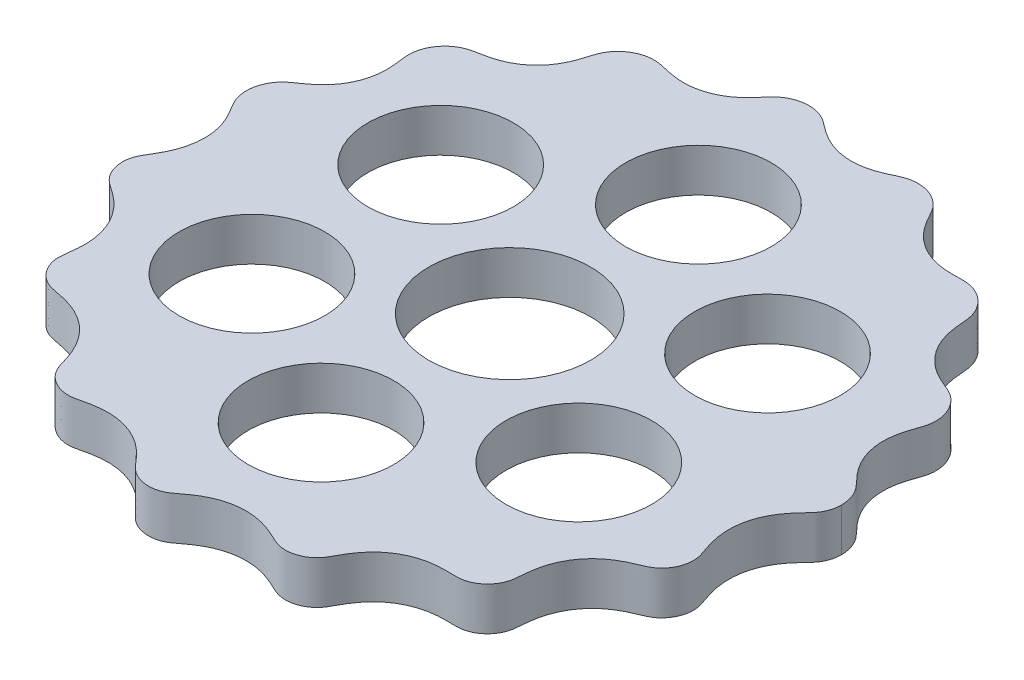
from build123d import *

# Parameters (mm, degrees)
SKETCH2_R           = 7.5
SKETCH2_R_2         = 6.75
BOSS_EXTRUDE1_DEPTH = 4


with BuildPart() as part:
    # Sketch2 → Boss-Extrude1 (new body)
    with BuildSketch(Plane(origin=(0, 0, 0), x_dir=(1, 0, 0), z_dir=(0, 1, 0))):
        with BuildLine():
            add(Edge.make_bspline(
                [(-29.5, 0), (-29.5, -0.029889461), (-29.500501274, -0.089793684), (-29.502757018, -0.199994007), (-29.508769472, -0.345716178), (-29.520033852, -0.516003517), (-29.539534103, -0.719877503), (-29.572667516, -0.972896461), (-29.625712231, -1.26893095), (-29.695940045, -1.57589139), (-29.785086374, -1.891206047), (-29.915742198, -2.279302585), (-30.102039584, -2.734864508), (-30.33495462, -3.200835277), (-30.612620381, -3.677587615), (-30.934069136, -4.194030434), (-31.237194706, -4.727278247), (-31.406093828, -5.378461077), (-31.405725242, -6.117189546), (-31.248335855, -6.800339452), (-30.946423484, -7.409498164), (-30.518681828, -7.912396516), (-30.024477359, -8.2774), (-29.550245165, -8.59502081), (-29.055422495, -8.956812811), (-28.55664588, -9.3787878), (-28.071291676, -9.87632012), (-27.618832314, -10.456259632), (-27.233514149, -11.088357289), (-26.923199049, -11.765079402), (-26.693739537, -12.478190143), (-26.549212855, -13.217291653), (-26.492855654, -13.928538721), (-26.50654453, -14.600813106), (-26.567292453, -15.230937345), (-26.651155977, -15.816199005), (-26.716674088, -16.447312982), (-26.62640489, -17.120976223), (-26.35876322, -17.782346644), (-25.918177073, -18.386904665), (-25.381295585, -18.836179949), (-24.795065003, -19.123538297), (-24.20416515, -19.259668921), (-23.651405896, -19.354435046), (-23.149147383, -19.460869188), (-22.701549759, -19.580730556), (-22.221250647, -19.739640946), (-21.713789444, -19.946736544), (-21.145635648, -20.241997885), (-20.533661927, -20.654546757), (-19.969318303, -21.140042744), (-19.462201082, -21.693788885), (-19.020819266, -22.308674205), (-18.671631778, -22.936971669), (-18.402935315, -23.560968071), (-18.196614764, -24.168544426), (-18.031210068, -24.746637991), (-17.836824154, -25.359563266), (-17.481845811, -25.947378552), (-16.962995745, -26.453160111), (-16.302610967, -26.834433706), (-15.605165751, -27.030879963), (-14.918614525, -27.044392858), (-14.290611017, -26.906273022), (-13.707268128, -26.76047143), (-13.077925596, -26.635361227), (-12.403190484, -26.556062439), (-11.684458703, -26.544316545), (-10.931287881, -26.619125576), (-10.198128539, -26.78142275), (-9.495575967, -27.027420956), (-8.914400316, -27.31099678), (-8.446794063, -27.597140689), (-8.075855138, -27.863479964), (-7.791280828, -28.092219953), (-7.481579097, -28.367944206), (-7.154069437, -28.695657759), (-6.810708629, -29.077401095), (-6.45228992, -29.50872604), (-6.038931991, -29.952392783), (-5.496965868, -30.316405455), (-4.839435928, -30.556720046), (-4.095583639, -30.636000314), (-3.38899707, -30.537099289), (-2.760454369, -30.27844327), (-2.246651709, -29.906145821), (-1.781732794, -29.540887108), (-1.266402425, -29.173215737), (-0.691041037, -28.825223584), (-0.046903188, -28.518406928), (0.66543903, -28.274019755), (1.397743593, -28.116182477), (2.138955211, -28.046561644), (2.879034252, -28.064209022), (3.607493969, -28.166079072), (4.281067062, -28.337644457), (4.895863657, -28.558606199), (5.456648804, -28.806245606), (5.968747032, -29.058121981), (6.532079721, -29.303629152), (7.181276314, -29.422592585), (7.882649472, -29.378078239), (8.594278351, -29.15231418), (9.198278317, -28.780347353), (9.667919205, -28.297811687), (9.987828208, -27.756370733), (10.260491808, -27.237871371), (10.576767616, -26.696230387), (10.953650895, -26.146870654), (11.408815704, -25.605953656), (11.950184555, -25.092464451), (12.548165998, -24.645439778), (13.194493936, -24.272282169), (13.88061938, -23.977927385), (14.595998502, -23.765832809), (15.292028768, -23.642107021), (15.956229893, -23.590396394), (16.583442648, -23.587314002), (17.168808068, -23.610430078), (17.79766419, -23.604101232), (18.450372779, -23.438648125), (19.074505483, -23.101552224), (19.625837334, -22.598145566), (20.015074466, -22.012995768), (20.23664741, -21.391293307), (20.305698303, -20.780679307), (20.343616085, -20.211251037), (20.409546628, -19.601777164), (20.525586467, -18.958866797), (20.713792994, -18.28975274), (20.98980086, -17.607953023), (21.344557209, -16.958202197), (21.775456582, -16.351104338), (22.2782997, -15.795828927), (22.846116736, -15.301115548), (23.433895979, -14.896684969), (24.022947843, -14.572402127), (24.599023965, -14.309950779), (25.147809675, -14.089945054), (25.727125692, -13.831132821), (26.26540634, -13.416119), (26.704339817, -12.853660239), (27.007624154, -12.169804958), (27.128243584, -11.480242215), (27.084026477, -10.828826935), (26.906402138, -10.249106449), (26.7122212, -9.722867749), (26.524712227, -9.148060531), (26.36609006, -8.521461383), (26.260469314, -7.840015999), (26.22782757, -7.109204715), (26.279232637, -6.372836761), (26.417456605, -5.641378167), (26.643471264, -4.925378903), (26.916327948, -4.321772504), (27.198539155, -3.829853606), (27.494220956, -3.391733715), (27.793312582, -3.00332682), (28.153637798, -2.591986094), (28.572215157, -2.159464513), (28.90921809, -1.789990126), (29.124632087, -1.45558278), (29.252718115, -1.193085775), (29.323765371, -1.017900193), (29.382904352, -0.838786396), (29.4301833, -0.65550882), (29.461173363, -0.493251706), (29.480345975, -0.355378471), (29.491402713, -0.233802562), (29.497298265, -0.132392574), (29.499508775, -0.061726851), (29.5, -0.020506856), (29.5, 0)],
                knots=[0.063267729, 0.063267729, 0.063267729, 0.063267729, 0.063267729, 0.064441566, 0.065615404, 0.066789241, 0.067963079, 0.070310753, 0.072658428, 0.075454292, 0.078250156, 0.081046021, 0.083841885, 0.089433613, 0.095025341, 0.098832185, 0.102639028, 0.110252715, 0.115841232, 0.121429749, 0.127692743, 0.133955737, 0.138834056, 0.143712374, 0.148590693, 0.153469011, 0.15973469, 0.166000368, 0.172266046, 0.178531725, 0.184946169, 0.191360613, 0.197775057, 0.204189501, 0.209244271, 0.214299041, 0.219353812, 0.224408582, 0.230819531, 0.23723048, 0.243460713, 0.249690946, 0.254485642, 0.259280338, 0.264075034, 0.26886973, 0.271985532, 0.275101335, 0.28133294, 0.287564545, 0.293796151, 0.300242347, 0.306688543, 0.313134739, 0.319580935, 0.324722071, 0.329863208, 0.335004344, 0.34014548, 0.346588344, 0.353031207, 0.359474071, 0.365916935, 0.371058071, 0.376199207, 0.381340343, 0.386481479, 0.392927675, 0.399373872, 0.405820068, 0.412266264, 0.418497869, 0.424729474, 0.427845277, 0.430961079, 0.434076882, 0.437192685, 0.441987381, 0.446782076, 0.451576772, 0.456371468, 0.462601701, 0.468831935, 0.475242884, 0.481653832, 0.486708603, 0.491763373, 0.496818143, 0.501872914, 0.508287358, 0.514701802, 0.521116246, 0.52753069, 0.533796368, 0.540062047, 0.546327725, 0.552593403, 0.557471722, 0.56235004, 0.567228359, 0.572106677, 0.578369671, 0.584632665, 0.590985014, 0.597337363, 0.602345806, 0.607354249, 0.612362692, 0.617371135, 0.623727028, 0.630082921, 0.636438814, 0.642794707, 0.649150601, 0.655506494, 0.661862387, 0.66821828, 0.673226723, 0.678235166, 0.683243609, 0.688252052, 0.694604401, 0.70095675, 0.707219744, 0.713482738, 0.718361056, 0.723239375, 0.728117693, 0.732996012, 0.73926169, 0.745527368, 0.751793047, 0.758058725, 0.764473169, 0.770887613, 0.777302057, 0.783716501, 0.788771271, 0.793826042, 0.798880812, 0.803935582, 0.810346531, 0.81675748, 0.822987713, 0.829217947, 0.834012643, 0.838807338, 0.843602034, 0.84839673, 0.854628335, 0.860859941, 0.867091546, 0.873323151, 0.879769347, 0.886215543, 0.89266174, 0.895884838, 0.899107936, 0.904249072, 0.909390208, 0.914531344, 0.91967248, 0.921283196, 0.922893912, 0.924504628, 0.926115344, 0.92772606, 0.929336776, 0.930142134, 0.930947492, 0.93175285, 0.932558208, 0.932558208, 0.932558208, 0.932558208, 0.932558208], degree=4))
            add(Edge.make_bspline(
                [(-29.5, 0), (-29.5, 0.036368434), (-29.500621596, 0.09131546), (-29.502693558, 0.185077643), (-29.510148197, 0.361383891), (-29.522769732, 0.525843813), (-29.54395108, 0.722381474), (-29.576471154, 0.938119797), (-29.608654368, 1.114824583), (-29.655683874, 1.334251882), (-29.722794364, 1.595120267), (-29.816321761, 1.895184338), (-29.942905227, 2.231367091), (-30.088016987, 2.559897452), (-30.249453231, 2.8807547), (-30.437064271, 3.215248503), (-30.648253129, 3.564379812), (-30.876267498, 3.931612679), (-31.090948572, 4.335960631), (-31.272071343, 4.827562864), (-31.377597247, 5.408998723), (-31.371256801, 6.075468708), (-31.207440431, 6.800692052), (-30.857409833, 7.553852099), (-30.258008776, 8.267781496), (-29.471751384, 8.748838362), (-28.736969619, 9.29109616), (-28.124001795, 9.864118534), (-27.640411398, 10.447475816), (-27.129620139, 11.254439263), (-26.768334401, 12.146087348), (-26.571864682, 13.090897718), (-26.5390431, 14.002290334), (-26.583137154, 14.667208577), (-26.662351086, 15.275505033), (-26.738062356, 15.832301537), (-26.742393783, 16.44847887), (-26.609986243, 17.106265896), (-26.324367094, 17.764435854), (-25.871758618, 18.383716884), (-25.243073231, 18.937204071), (-24.415937553, 19.351052264), (-23.509745681, 19.475458796), (-22.624283062, 19.664022975), (-21.835580629, 19.930979231), (-21.159206525, 20.257601087), (-20.522714477, 20.671749686), (-19.943254967, 21.170920313), (-19.430986717, 21.748235134), (-18.99795216, 22.394184544), (-18.673825359, 23.042764023), (-18.43865844, 23.671799379), (-18.260142238, 24.263839372), (-18.103870248, 24.807890763), (-17.860568877, 25.379341345), (-17.473868703, 25.933835711), (-16.93953807, 26.429329074), (-16.262452666, 26.820251703), (-15.566178294, 27.035232605), (-14.892613884, 27.092903159), (-14.276090593, 27.017840484), (-13.726753174, 26.881233459), (-13.124850061, 26.739654937), (-12.462373078, 26.629069364), (-11.544830915, 26.573268487), (-10.580848277, 26.679857518), (-9.657973998, 26.956694821), (-8.807815259, 27.388576277), (-8.186652935, 27.811251131), (-7.561177289, 28.360674171), (-6.955102817, 29.033310248), (-6.394292752, 29.755841033), (-5.622308576, 30.265264641), (-4.828639224, 30.532963445), (-4.066017393, 30.615302953), (-3.353218763, 30.533564826), (-2.717353146, 30.319344117), (-2.185894266, 30.007500816), (-1.741550353, 29.663538306), (-1.254355438, 29.290783976), (-0.700569741, 28.920145342), (0.105136602, 28.492861252), (1.021590141, 28.190624218), (1.974439744, 28.057652278), (2.928662981, 28.096570656), (3.675697838, 28.223626259), (4.478366835, 28.468080899), (5.315482939, 28.833083009), (6.125040824, 29.273793274), (7.043268076, 29.435485293), (7.882374119, 29.361597135), (8.615767486, 29.129001695), (9.352669377, 28.700136948), (10.022769642, 28.020272694), (10.425696617, 27.167624848), (10.900105143, 26.362927183), (11.53652116, 25.531866345), (12.384489051, 24.744983774), (13.393790039, 24.162263577), (14.499234281, 23.821343127), (15.537162088, 23.685721108), (16.47125497, 23.677220105), (17.411133153, 23.754599032), (18.334963001, 23.514207306), (19.074821712, 23.090463923), (19.642951955, 22.571624355), (20.126494, 21.881881286), (20.445578227, 21.005827146), (20.468690889, 20.084374327), (20.571147832, 19.176909446), (20.760778418, 18.359550406), (21.024262441, 17.649071403), (21.467669803, 16.803230721), (22.059251597, 16.0445246), (22.779223453, 15.401971279), (23.552115308, 14.917850869), (24.149990944, 14.623578185), (24.716402567, 14.388031333), (25.23645572, 14.175200879), (25.772247932, 13.870863433), (26.275703605, 13.427301494), (26.702886564, 12.850863278), (27.012894879, 12.149252027), (27.177886779, 11.328051389), (27.122721012, 10.404805934), (26.777366021, 9.557819085), (26.497933268, 8.696701205), (26.334777417, 7.880191014), (26.279445431, 7.131115466), (26.319876141, 6.372835912), (26.462417955, 5.6214019), (26.706291447, 4.889144099), (27.049118221, 4.191088253), (27.448847466, 3.586198984), (27.875854015, 3.067856272), (28.29959419, 2.617503729), (28.692150182, 2.209686885), (28.978290933, 1.83058794), (29.160543402, 1.495917336), (29.273152612, 1.232116224), (29.338106626, 1.049329239), (29.392437424, 0.863300635), (29.43581157, 0.674358774), (29.464300856, 0.506342177), (29.481924466, 0.364940833), (29.492092234, 0.241193166), (29.497514758, 0.13656483), (29.499548141, 0.063164598), (29.5, 0.020942122), (29.5, 0)],
                knots=[0.065559413, 0.065559413, 0.065559413, 0.065559413, 0.065559413, 0.066989845, 0.067705061, 0.068420277, 0.07128114, 0.072807201, 0.074333261, 0.075859322, 0.077385383, 0.080437504, 0.083489625, 0.086541746, 0.089593867, 0.092645988, 0.095698109, 0.099582087, 0.103466065, 0.107350043, 0.11123402, 0.11733661, 0.1234392, 0.129867048, 0.136294896, 0.145417973, 0.154541049, 0.160971445, 0.16740184, 0.173832236, 0.180262631, 0.193345432, 0.199886833, 0.206428233, 0.211202405, 0.215976577, 0.220750748, 0.22552492, 0.232063041, 0.238601161, 0.244977203, 0.251353245, 0.260403457, 0.26945367, 0.275831794, 0.282209918, 0.288588043, 0.294966167, 0.301559539, 0.308152911, 0.314746282, 0.321339654, 0.326150764, 0.330961875, 0.335772985, 0.340584095, 0.347173607, 0.353763118, 0.36035263, 0.366942142, 0.371753252, 0.376564362, 0.381375472, 0.386186582, 0.392779954, 0.399373326, 0.41256007, 0.418938194, 0.425316318, 0.431694443, 0.438072567, 0.447122779, 0.456172992, 0.462549034, 0.468925076, 0.475463196, 0.482001316, 0.486775488, 0.49154966, 0.496323832, 0.501098004, 0.507639404, 0.514180804, 0.527263605, 0.533694001, 0.540124396, 0.546554792, 0.552985187, 0.562108264, 0.57123134, 0.577659189, 0.584087037, 0.590603563, 0.597120089, 0.606505906, 0.615891722, 0.622410477, 0.628929233, 0.641966744, 0.655004255, 0.661523011, 0.668041766, 0.677427582, 0.686813399, 0.693329925, 0.699846451, 0.706274299, 0.712702148, 0.721825224, 0.730948301, 0.737378696, 0.743809092, 0.750239487, 0.756669883, 0.769752683, 0.776294084, 0.782835484, 0.787609656, 0.792383828, 0.797158, 0.801932172, 0.808470292, 0.815008412, 0.821384454, 0.827760496, 0.836810709, 0.845860921, 0.852239045, 0.85861717, 0.864995294, 0.871373418, 0.87796679, 0.884560162, 0.891153534, 0.897746905, 0.902558016, 0.907369126, 0.912180236, 0.916991346, 0.918638724, 0.920286102, 0.92193348, 0.923580858, 0.925228236, 0.926875614, 0.927699303, 0.928522992, 0.929346681, 0.93017037, 0.93017037, 0.93017037, 0.93017037, 0.93017037], degree=4))
        make_face()
        with Locations(Location((-1.25, 0, 0), (0, 0, 270))):
            Circle(SKETCH2_R, mode=Mode.SUBTRACT)
        with Locations(Location((-1.25, 17.5, 0), (0, 0, 270))):
            Circle(SKETCH2_R_2, mode=Mode.SUBTRACT)
        with Locations(Location((13.905444566, 8.75, 0), (0, 0, 270))):
            Circle(SKETCH2_R_2, mode=Mode.SUBTRACT)
        with Locations(Location((13.905444566, -8.75, 0), (0, 0, 270))):
            Circle(SKETCH2_R_2, mode=Mode.SUBTRACT)
        with Locations(Location((-1.25, -17.5, 0), (0, 0, 270))):
            Circle(SKETCH2_R_2, mode=Mode.SUBTRACT)
        with Locations(Location((-16.405444566, -8.75, 0), (0, 0, 270))):
            Circle(SKETCH2_R_2, mode=Mode.SUBTRACT)
        with Locations(Location((-16.405444566, 8.75, 0), (0, 0, 270))):
            Circle(SKETCH2_R_2, mode=Mode.SUBTRACT)
    extrude(amount=BOSS_EXTRUDE1_DEPTH)


solid = part.part
